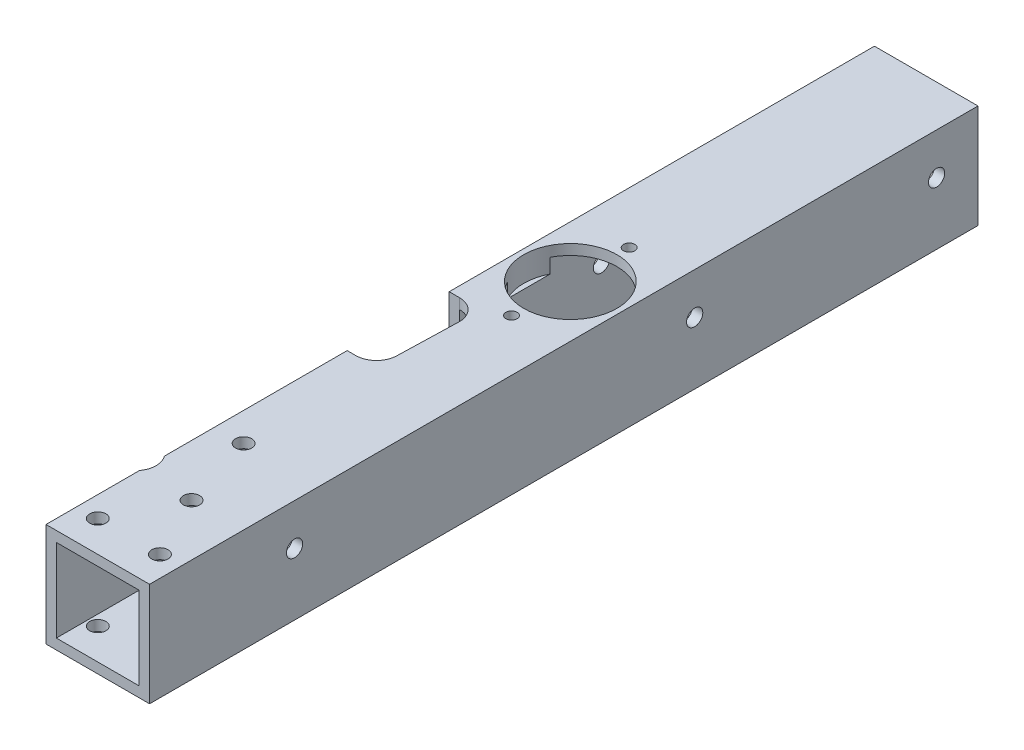
from build123d import *

# Parameters (mm, degrees)
BOSS_EXTRUDE1_DEPTH           = 127
BOSS_EXTRUDE1_DEPTH_BACK      = 127
SKETCH3_W                     = 31.75
SKETCH3_H                     = 31.75
SKETCH3_W_2                   = 25.4
SKETCH3_H_2                   = 25.4
F_10_CLEARANCE_HOLE1_D        = 4.9784
SKETCH7_R                     = 14.2875
CUT_EXTRUDE1_DEPTH            = 7.62
CUT_EXTRUDE2_START            = -7.62
SKETCH8_R                     = 14.2875
CUT_EXTRUDE2_DEPTH            = 7.62
CUT_EXTRUDE3_DEPTH            = 132.867653824
F_10_CLEARANCE_HOLE2_D        = 4.9784
SKETCH13_R                    = 6.35
CUT_EXTRUDE4_DEPTH            = 132.867653824
TAP_DRILL_FOR_8_32_TAP1_D     = 3.4544
TAP_DRILL_FOR_8_32_TAP1_DEPTH = 5.08
TAP_DRILL_FOR_8_32_TAP1_TIP   = 1.037806461


with BuildPart() as part:
    # Sketch3 → Boss-Extrude1 (new, two sides: drawn at the far end of the back side and taken through both)
    with BuildSketch(Plane.XY.offset(-BOSS_EXTRUDE1_DEPTH_BACK)):
        Rectangle(SKETCH3_W, SKETCH3_H)
        Rectangle(SKETCH3_W_2, SKETCH3_H_2, mode=Mode.SUBTRACT)
    extrude(amount=BOSS_EXTRUDE1_DEPTH + BOSS_EXTRUDE1_DEPTH_BACK)

    # #10 Clearance Hole1 (through all)
    with Locations(Plane(origin=(0, 15.875, 0), x_dir=(1, 0, 0), z_dir=(0, 1, 0))):
        with Locations((-9.525, -117.475), (9.525, -117.475), (0, -98.247200001), (-7.111939052, -75.171256705)):
            Hole(F_10_CLEARANCE_HOLE1_D / 2)

    # Sketch7 → Cut-Extrude1 (cut)
    with BuildSketch(Plane(origin=(0, 15.875, 0), x_dir=(1, 0, 0), z_dir=(0, 1, 0))):
        with Locations(Location((0, 17.8816, 0), (0, 0, 270))):
            Circle(SKETCH7_R)
    extrude(amount=-CUT_EXTRUDE1_DEPTH, mode=Mode.SUBTRACT)

    # Sketch8 → Cut-Extrude2 (cut)
    with BuildSketch(Plane.XZ.offset(15.875).offset(CUT_EXTRUDE2_START)):
        with Locations(Location((0, -17.8816, 0), (0, 0, 90))):
            Circle(SKETCH8_R)
    extrude(amount=CUT_EXTRUDE2_DEPTH, mode=Mode.SUBTRACT)

    # Sketch9 → Cut-Extrude3 (cut, through all)
    with BuildSketch(Plane.XZ.offset(15.875)):
        with BuildLine():
            Line((-15.875, 34.663398263), (-15.875, 3.38353779))
            Line((-15.875, 3.38353779), (-12.7, 3.38353779))
            ThreePointArc((-12.7, 3.38353779), (-8.209871939, 5.243409729), (-6.35, 9.73353779))
            Line((-6.35, 9.73353779), (-6.883240315, 28.313398263))
            ThreePointArc((-6.883240315, 28.313398263), (-8.743112255, 32.803526323), (-13.233240315, 34.663398263))
            Line((-13.233240315, 34.663398263), (-15.875, 34.663398263))
        make_face()
    extrude(amount=-CUT_EXTRUDE3_DEPTH, mode=Mode.SUBTRACT)

    # #10 Clearance Hole2 (through all)
    with Locations(Plane(origin=(15.875, 0, 0), x_dir=(0, 0, -1), z_dir=(1, 0, 0))):
        with Locations((-82.55, 3.175), (114.3, 3.175), (40.132, 3.175)):
            Hole(F_10_CLEARANCE_HOLE2_D / 2)

    # Sketch13 → Cut-Extrude4 (cut, through all)
    with BuildSketch(Plane.XZ.offset(15.875)):
        with Locations((-20.955, 94.525686877)):
            Circle(SKETCH13_R)
    extrude(amount=-CUT_EXTRUDE4_DEPTH, mode=Mode.SUBTRACT)

    # Tap Drill for #8-32 Tap1
    with Locations(Plane(origin=(0, 15.875, 0), x_dir=(1, 0, 0), z_dir=(0, 1, 0))):
        with Locations((0, 35.9156), (0, -0.1524)):
            Hole(TAP_DRILL_FOR_8_32_TAP1_D / 2, depth=TAP_DRILL_FOR_8_32_TAP1_DEPTH)
            with Locations((0, 0, -(TAP_DRILL_FOR_8_32_TAP1_DEPTH + TAP_DRILL_FOR_8_32_TAP1_TIP / 2))):  # 118° drill point
                Cone(0, TAP_DRILL_FOR_8_32_TAP1_D / 2, TAP_DRILL_FOR_8_32_TAP1_TIP, mode=Mode.SUBTRACT)


solid = part.part
